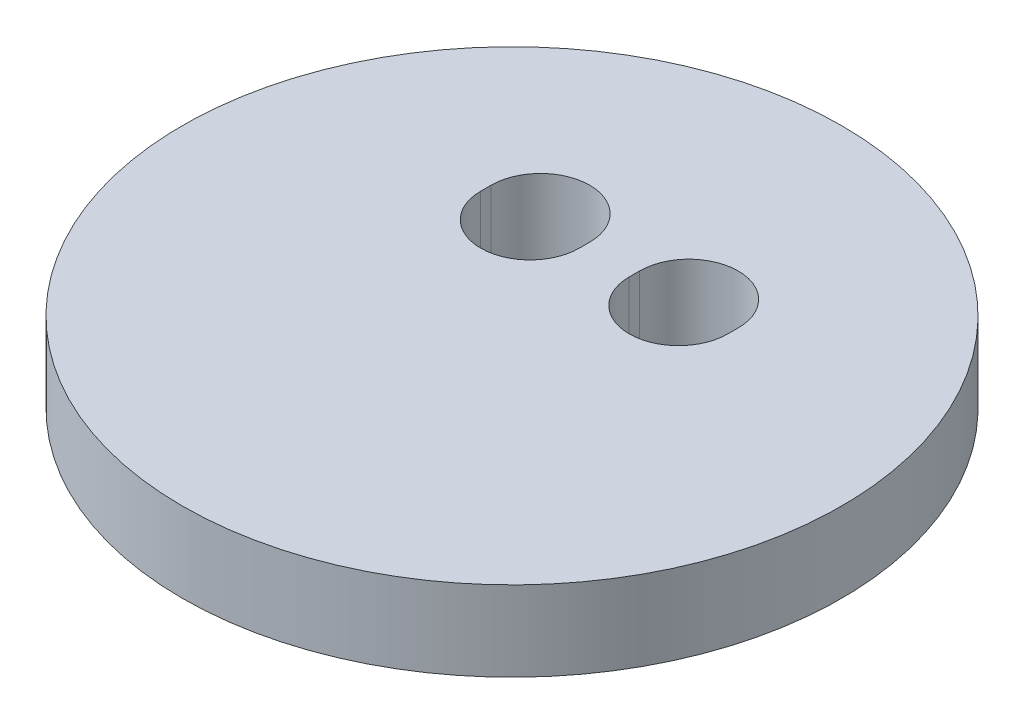
from build123d import *

# Parameters (mm, degrees)
SKETCH1_R           = 12.36
BOSS_EXTRUDE1_DEPTH = 3
CUT_EXTRUDE1_DEPTH  = 18.735253029


with BuildPart() as part:
    # Sketch1 → Boss-Extrude1 (new body)
    with BuildSketch(Plane(origin=(0, 0, 0), x_dir=(1, 0, 0), z_dir=(0, 1, 0))):
        with Locations(Location((0, 0, 0), (0, 0, 270))):
            Circle(SKETCH1_R)
    extrude(amount=BOSS_EXTRUDE1_DEPTH)

    # Sketch2 → Cut-Extrude1 (cut, through all)
    with BuildSketch(Plane(origin=(0, 3, 0), x_dir=(1, 0, 0), z_dir=(0, 1, 0))):
        with BuildLine():
            Line((4.635, 3.85), (4.635, 3.46))
            ThreePointArc((4.635, 3.46), (2.785, 1.61), (0.935, 3.46))
            Line((0.935, 3.46), (0.935, 3.85))
            ThreePointArc((0.935, 3.85), (2.785, 5.7), (4.635, 3.85))
        make_face()
        with BuildLine():
            Line((-0.935, 3.85), (-0.935, 3.46))
            ThreePointArc((-0.935, 3.46), (-2.785, 1.61), (-4.635, 3.46))
            Line((-4.635, 3.46), (-4.635, 3.85))
            ThreePointArc((-4.635, 3.85), (-2.785, 5.7), (-0.935, 3.85))
        make_face()
    extrude(amount=-CUT_EXTRUDE1_DEPTH, mode=Mode.SUBTRACT)


solid = part.part
